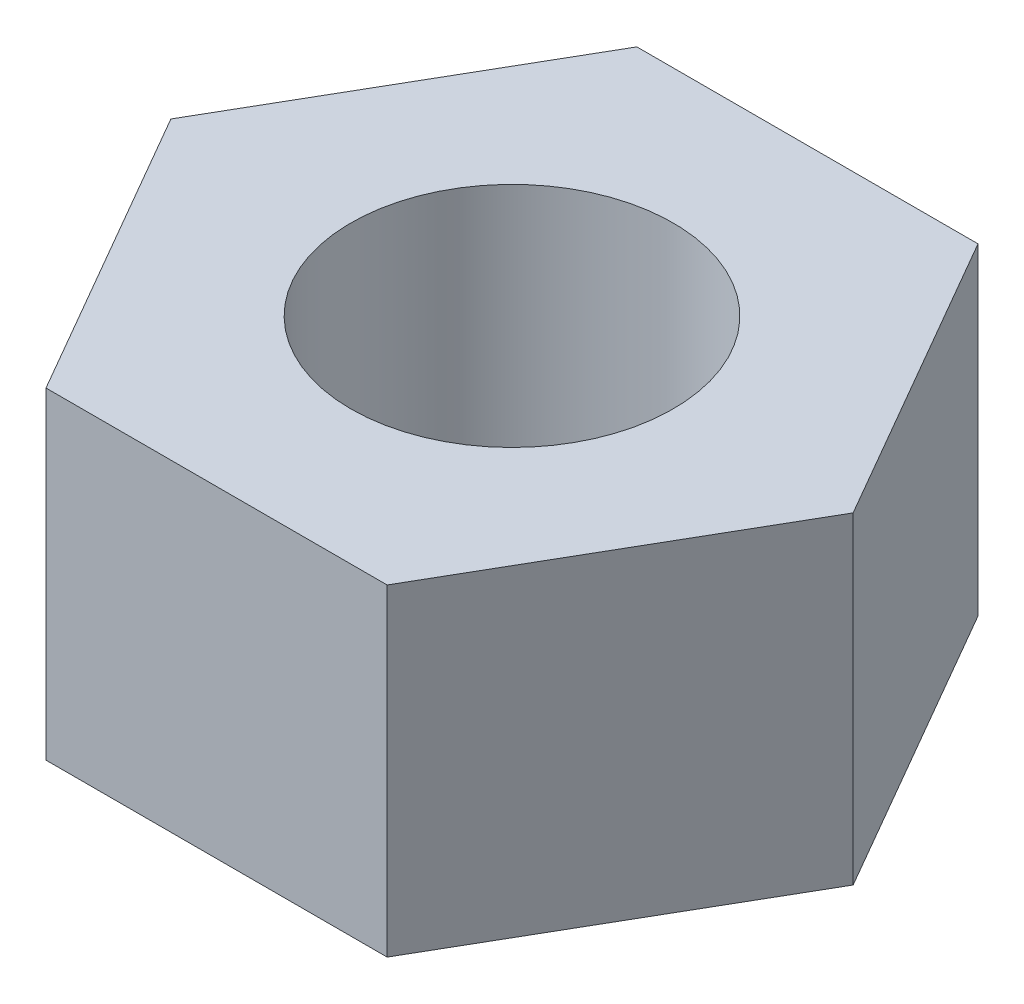
from build123d import *

# Parameters (mm, degrees)
SKETCH_1_R      = 1.5
EXTRUDE_1_DEPTH = 3


with BuildPart() as part:
    # 草图1 → 凸台-拉伸1 (new body)
    with BuildSketch(Plane(origin=(0, 0, 0), x_dir=(1, 0, 0), z_dir=(0, 1, 0))):
        Polygon((3.175426481, 0), (1.58771324, 2.75), (-1.58771324, 2.75), (-3.175426481, 0), (-1.58771324, -2.75), (1.58771324, -2.75), align=None)
        with Locations(Location((0, 0, 0), (0, 0, 270))):
            Circle(SKETCH_1_R, mode=Mode.SUBTRACT)
    extrude(amount=EXTRUDE_1_DEPTH)


solid = part.part
